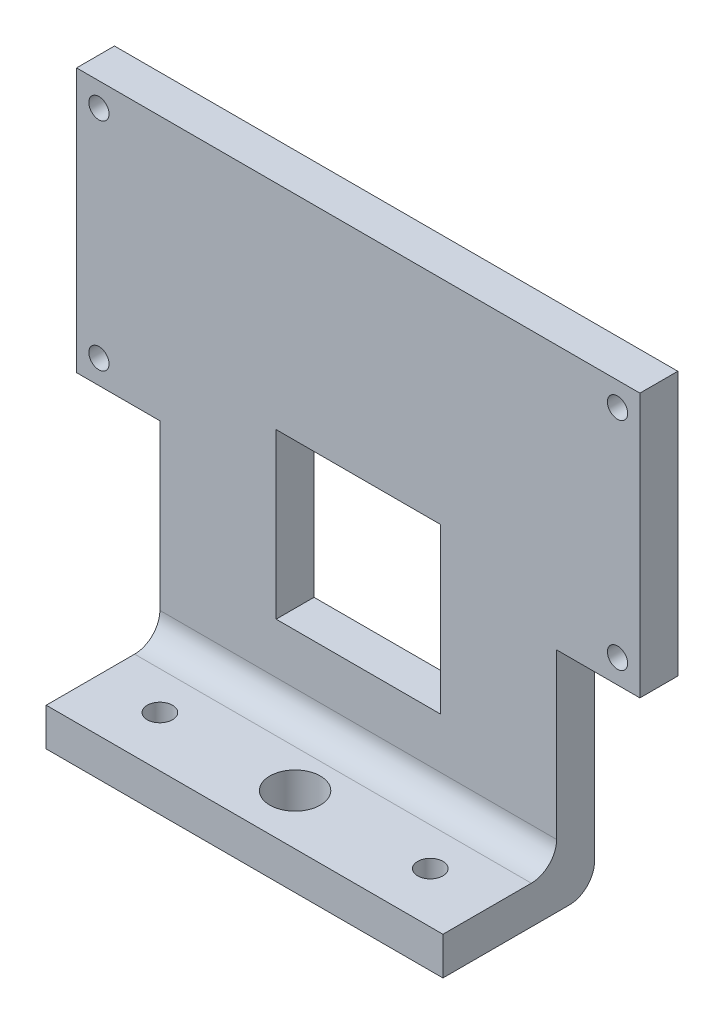
from build123d import *

# Parameters (mm, degrees)
SKETCH1_R           = 1
BOSS_EXTRUDE1_DEPTH = 3
SKETCH2_R           = 0.8
BOSS_EXTRUDE2_DEPTH = 3
FILLET1_R           = 2


with BuildPart() as part:
    # Sketch1 → Boss-Extrude1 (new body)
    with BuildSketch(Plane(origin=(0, 0, 0), x_dir=(1, 0, 0), z_dir=(0, 1, 0))):
        with BuildLine():
            Line((0, -3), (0, -5))
            Line((0, -5), (-15.705, -5))
            Line((-15.705, -5), (-15.705, 7))
            Line((-15.705, 7), (0, 7))
            Line((0, 7), (0, 1))
            ThreePointArc((0, 1), (-2, -1), (0, -3))
        make_face()
        with Locations(Location((-10.705, -1, 0), (0, 0, 270))):
            Circle(SKETCH1_R, mode=Mode.SUBTRACT)
    boss_extrude1 = extrude(amount=BOSS_EXTRUDE1_DEPTH)

    # Sketch2 → Boss-Extrude2 (add)
    with BuildSketch(Plane(origin=(0, 0, -7), x_dir=(-1, 0, 0), z_dir=(0, 0, -1))):
        Polygon((15.705, 3), (15.705, 18), (22.3, 18), (22.3, 38.9), (0, 38.9), (0, 22), (6.5, 22), (6.5, 9), (0, 9), (0, 3), align=None)
        with Locations((20.53, 19.88)):
            Circle(SKETCH2_R, mode=Mode.SUBTRACT)
        with Locations(Location((20.53, 37.02, 0), (0, 0, 180))):
            Circle(SKETCH2_R, mode=Mode.SUBTRACT)
    boss_extrude2 = extrude(amount=-BOSS_EXTRUDE2_DEPTH)

    # Mirror1: Boss-Extrude1, Boss-Extrude2 across plane
    add(boss_extrude1.mirror(Plane(origin=(0, 0, 0), x_dir=(0, 0, 1), z_dir=(1, 0, 0))))
    add(boss_extrude2.mirror(Plane(origin=(0, 0, 0), x_dir=(0, 0, 1), z_dir=(1, 0, 0))))

    # Fillet1
    fillet1_edges = [part.edges().sort_by_distance(p)[0] for p in [
        (0, 3, -4),
        (0, 0, -7),
    ]]
    fillet(fillet1_edges, radius=FILLET1_R)


solid = part.part
